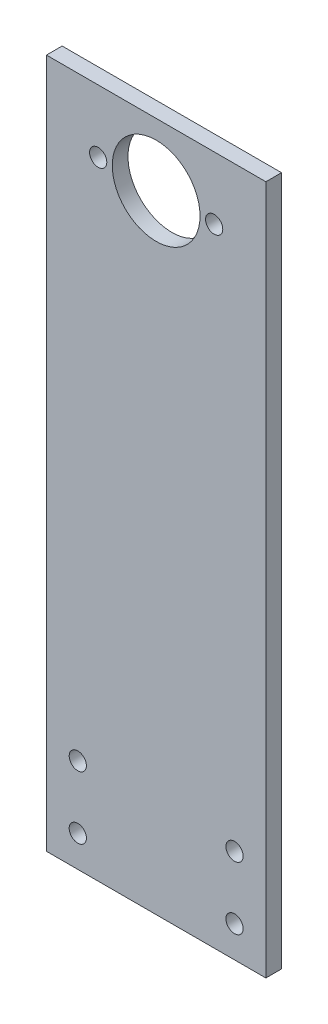
from build123d import *

# Parameters (mm, degrees)
SKETCH1_R           = 14
SKETCH1_R_2         = 2.75
BOSS_EXTRUDE1_DEPTH = 5


with BuildPart() as part:
    # Sketch1 → Boss-Extrude1 (new body)
    with BuildSketch(Plane.XY):
        Polygon((-35, -120), (35, -120), (35, -100), (35, 100), (-35, 100), (-35, -100), align=None)
        with Locations((0, 80)):
            Circle(SKETCH1_R, mode=Mode.SUBTRACT)
        with Locations((-25, -110)):
            Circle(SKETCH1_R_2, mode=Mode.SUBTRACT)
        with Locations((25, -110)):
            Circle(SKETCH1_R_2, mode=Mode.SUBTRACT)
        with Locations((25, -90)):
            Circle(SKETCH1_R_2, mode=Mode.SUBTRACT)
        with Locations((-25, -90)):
            Circle(SKETCH1_R_2, mode=Mode.SUBTRACT)
        with Locations((18.5, 80)):
            Circle(SKETCH1_R_2, mode=Mode.SUBTRACT)
        with Locations((-18.5, 80)):
            Circle(SKETCH1_R_2, mode=Mode.SUBTRACT)
    extrude(amount=BOSS_EXTRUDE1_DEPTH)


solid = part.part
